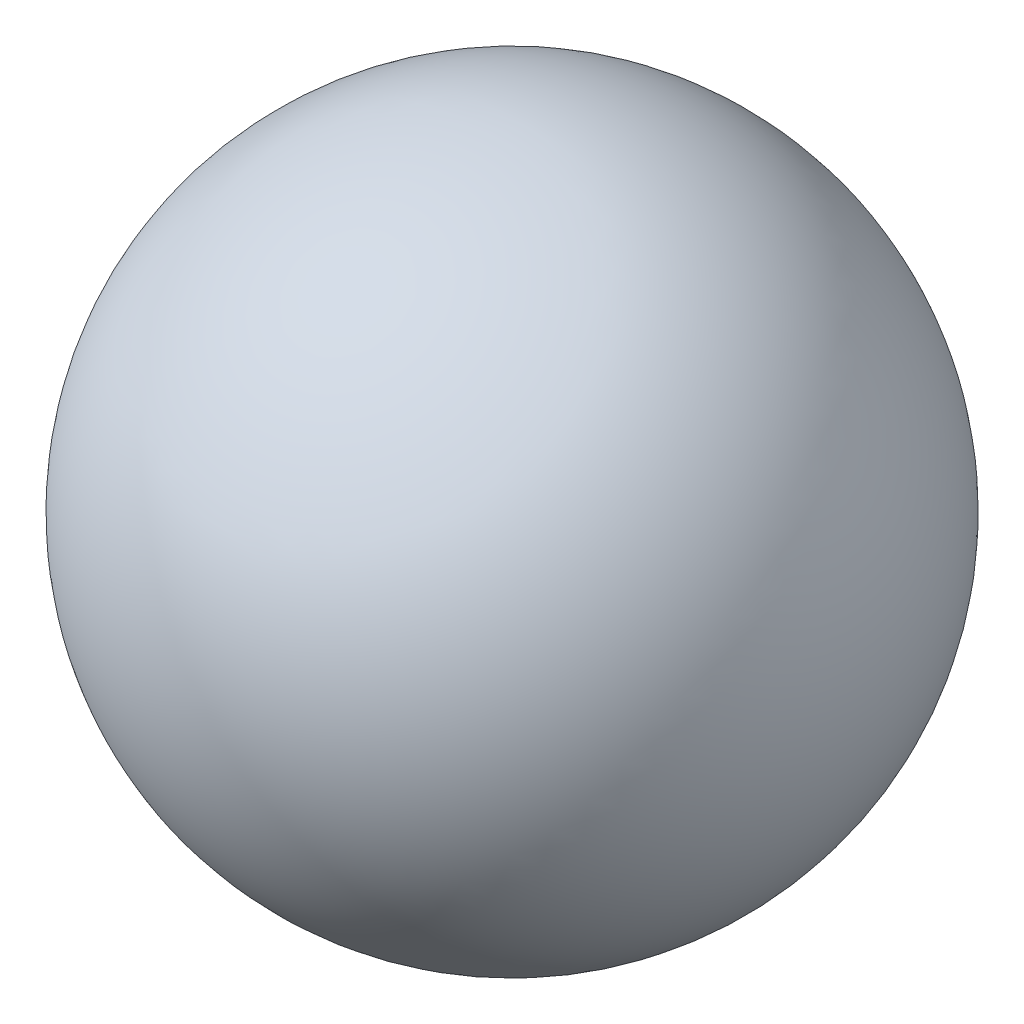
from build123d import *


with BuildPart() as part:
    # Sketch1 → Revolve1 (revolve)
    with BuildSketch(Plane.YZ):
        with BuildLine():
            Line((0, 6.35), (0, 0))
            Line((0, 0), (0, -6.35))
            ThreePointArc((0, -6.35), (6.35, 0), (0, 6.35))
        make_face()
    revolve(axis=Axis((0, 0, 0), (0, 0, 1)))


solid = part.part
